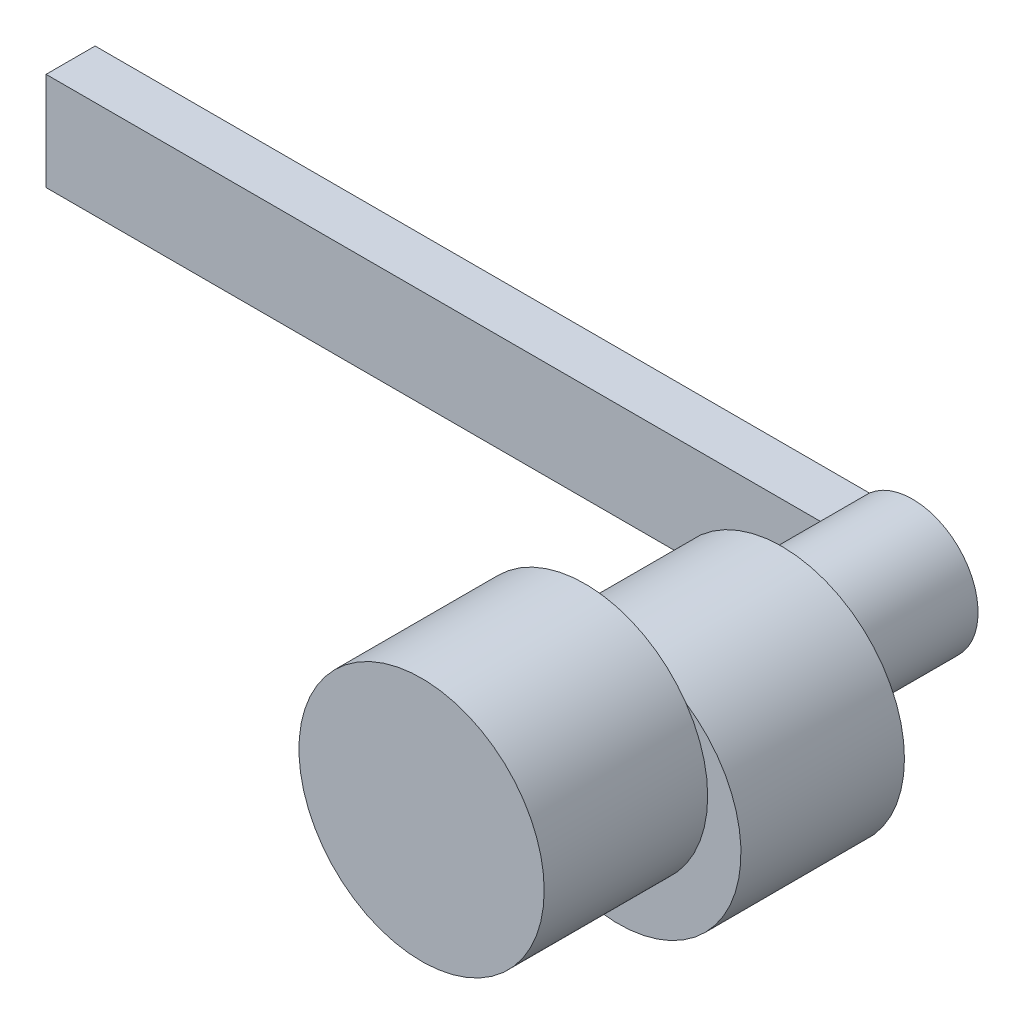
from build123d import *

# Parameters (mm, degrees)
SKETCH1_R           = 4
BOSS_EXTRUDE1_DEPTH = 10
SKETCH2_R           = 7.5
BOSS_EXTRUDE2_DEPTH = 10
SKETCH3_W           = 2.232233047
SKETCH3_H           = 0.5
CUT_EXTRUDE1_DEPTH  = 0.1
SKETCH6_R           = 7.5
BOSS_EXTRUDE5_DEPTH = 10
SKETCH7_W           = 50
SKETCH7_H           = 6
BOSS_EXTRUDE6_DEPTH = 3


with BuildPart() as part:
    # Sketch1 → Boss-Extrude1 (new body)
    with BuildSketch(Plane.XY):
        Circle(SKETCH1_R)
    extrude(amount=BOSS_EXTRUDE1_DEPTH)

    # Sketch2 → Boss-Extrude2 (add)
    with BuildSketch(Plane.XY.offset(10)):
        with Locations((2, 0)):
            Circle(SKETCH2_R)
    extrude(amount=BOSS_EXTRUDE2_DEPTH)

    # Sketch3 → Cut-Extrude1 (cut)
    with BuildSketch(Plane.XY.offset(20)):
        Polygon((-1.5, 0.5), (-0.232233047, 0.5), (-0.232233047, 1.767766953), align=None)
        Polygon((-2, 0), (-0.232233047, 0), (-0.232233047, 0.5), (-1.5, 0.5), align=None)
        Polygon((-0.232233047, -0.5), (-0.232233047, 0), (-2, 0), (-1.5, -0.5), align=None)
        Polygon((-0.232233047, -1.767766953), (-0.232233047, -0.5), (-1.5, -0.5), align=None)
        with Locations((0.883883476, 0.25)):
            Rectangle(SKETCH3_W, SKETCH3_H)
        with Locations((0.883883476, -0.25)):
            Rectangle(SKETCH3_W, SKETCH3_H)
    extrude(amount=-CUT_EXTRUDE1_DEPTH, mode=Mode.SUBTRACT)

    # Sketch6 → Boss-Extrude5 (add)
    with BuildSketch(Plane.XY.offset(20)):
        with Locations(Location((-0.034904813, 1.99969539, 0), (0, 0, 236.464463187))):
            Circle(SKETCH6_R)
    extrude(amount=BOSS_EXTRUDE5_DEPTH)

    # Sketch7 → Boss-Extrude6 (add)
    with BuildSketch(Plane(origin=(0, 0, 0), x_dir=(-1, 0, 0), z_dir=(0, 0, -1))):
        with Locations((25, 0)):
            Rectangle(SKETCH7_W, SKETCH7_H)
    extrude(amount=-BOSS_EXTRUDE6_DEPTH)


solid = part.part
